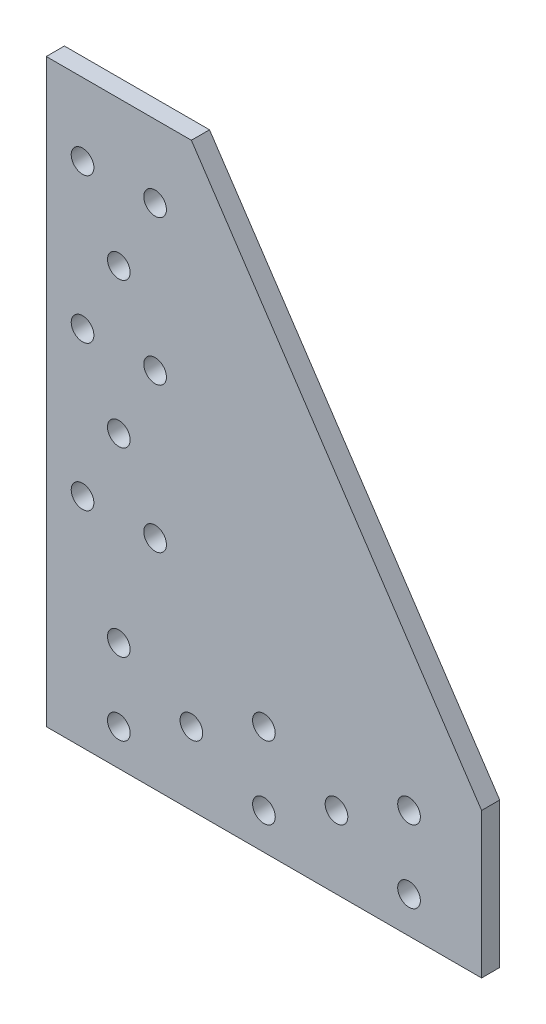
from build123d import *

# Parameters (mm, degrees)
BOSS_EXTRUDE1_DEPTH              = 3.175
F_97_0_0059_DIAMETER_HOLE1_D     = 3.96875
F_97_0_0059_DIAMETER_HOLE1_DEPTH = 6.349
F_97_0_0059_DIAMETER_HOLE1_TIP   = 1.192332791


with BuildPart() as part:
    # Sketch1 (on Front Plane) → Boss-Extrude1 (new body)
    with BuildSketch(Plane.XY):
        Polygon((-12.7, -584.2), (-12.7, -482.6), (12.7, -482.6), (63.5, -558.8), (63.5, -584.2), align=None)
    extrude(amount=BOSS_EXTRUDE1_DEPTH)

    # #97 (0.0059) Diameter Hole1
    with Locations(Plane(origin=(-12.7, -584.2, 3.175), x_dir=(0, -1, 0), z_dir=(0, 0, 1))):
        with Locations((-88.9, 6.35), (-88.9, 19.05), (-76.2, 12.7), (-63.5, 6.35), (-63.5, 19.05), (-50.8, 12.7), (-38.1, 6.35), (-38.1, 19.05), (-6.35, 12.7), (-19.05, 12.7), (-12.7, 25.4), (-19.05, 38.1), (-6.35, 38.1), (-12.7, 50.8), (-19.05, 63.5), (-6.35, 63.5)):
            Hole(F_97_0_0059_DIAMETER_HOLE1_D / 2, depth=F_97_0_0059_DIAMETER_HOLE1_DEPTH)
            with Locations((0, 0, -(F_97_0_0059_DIAMETER_HOLE1_DEPTH + F_97_0_0059_DIAMETER_HOLE1_TIP / 2))):  # 118° drill point
                Cone(0, F_97_0_0059_DIAMETER_HOLE1_D / 2, F_97_0_0059_DIAMETER_HOLE1_TIP, mode=Mode.SUBTRACT)


solid = part.part
